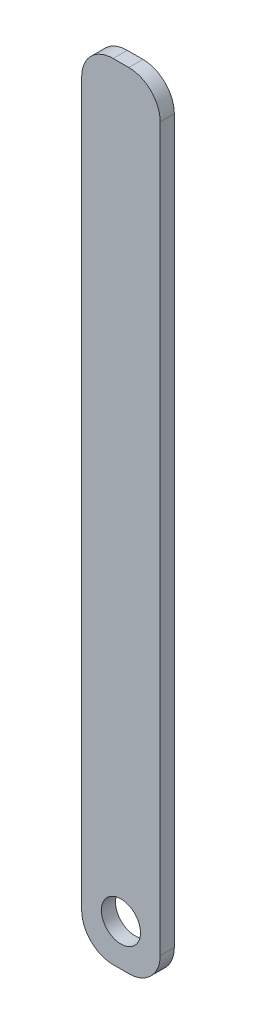
from build123d import *

# Parameters (mm, degrees)
SKETCH7_W           = 50
SKETCH7_H           = 500
BOSS_EXTRUDE1_DEPTH = 4.5
FILLET1_R           = 20
SKETCH9_R           = 12.457833995
CUT_EXTRUDE2_DEPTH  = 10


with BuildPart() as part:
    # Sketch7 → Boss-Extrude1 (new, symmetric)
    with BuildSketch(Plane.XY):
        with Locations((12.3, -21.4)):
            Rectangle(SKETCH7_W, SKETCH7_H)
    extrude(amount=BOSS_EXTRUDE1_DEPTH, both=True)

    # Fillet1
    fillet1_edges = [part.edges().sort_by_distance(p)[0] for p in [
        (-12.7, 228.6, 0),
        (37.3, 228.6, 0),
        (37.3, -271.4, 0),
        (-12.7, -271.4, 0),
    ]]
    fillet(fillet1_edges, radius=FILLET1_R)

    # Sketch9 → Cut-Extrude2 (cut)
    with BuildSketch(Plane.XY.offset(4.5)):
        with Locations((12.3, -245.065350927)):
            Circle(SKETCH9_R)
    extrude(amount=-CUT_EXTRUDE2_DEPTH, mode=Mode.SUBTRACT)


solid = part.part
